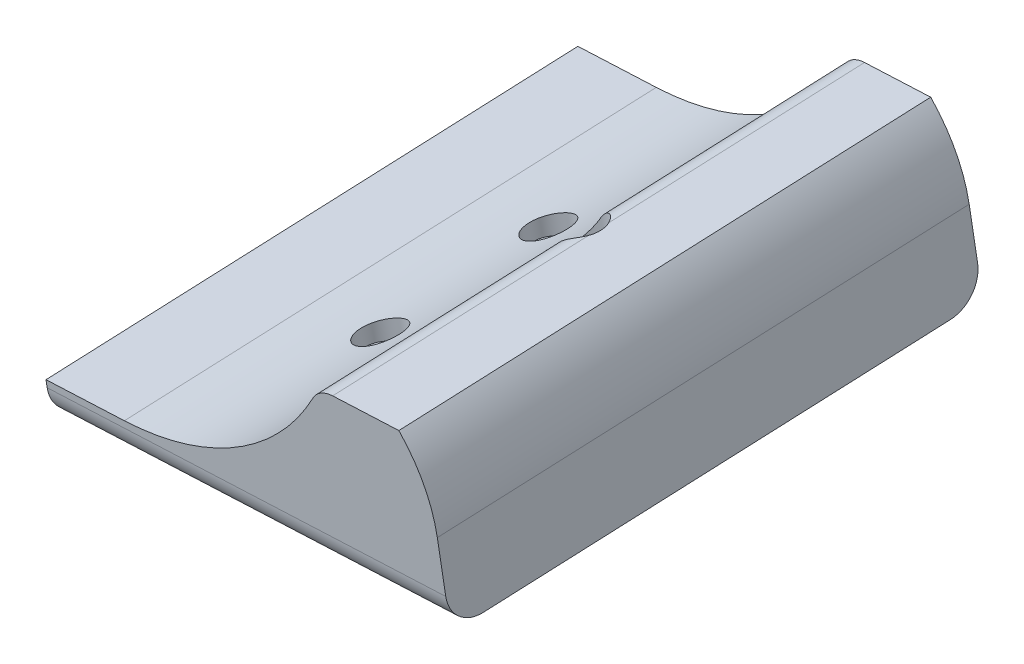
from build123d import *

# Parameters (mm, degrees)
EXTRUDE_1_DEPTH     = 75
CUT_EXTRUDE_2_DEPTH = 89
CUT_EXTRUDE_3_DEPTH = 89
CUT_EXTRUDE_4_DEPTH = 102
FILLET_1_R          = 4
SKETCH_8_R          = 1.7
CUT_EXTRUDE_5_DEPTH = 27
SKETCH_9_R          = 3.1
CUT_EXTRUDE_6_DEPTH = 19.5


with BuildPart() as part:
    # 草图1 → 凸台-拉伸1 (new body)
    with BuildSketch(Plane(origin=(-39.59611161, -89.310119263, 1121.416485544), x_dir=(-0.9993811405079087, 0.0027925735986707154, -0.035064761938558196), z_dir=(0.03517578708588839, 0.07933995566829549, -0.9962267991965691))):
        with BuildLine():
            Line((-262.075571521, 359.155993571), (-261.628696205, 364.135983777))
            Line((-261.628696205, 364.135983777), (-261.435860549, 366.284949367))
            ThreePointArc((-261.435860549, 366.284949367), (-261.109064157, 368.074809297), (-260.463371375, 369.775831132))
            Line((-260.463371375, 369.775831132), (-248.776723549, 393.730780012))
            ThreePointArc((-248.776723549, 393.730780012), (-256.744007891, 423.508755886), (-287.342992795, 419.779467775))
            Line((-287.342992795, 419.779467775), (-315.661768776, 388.401500241))
            ThreePointArc((-315.661768776, 388.401500241), (-319.142063417, 383.007701172), (-320.734355269, 376.78917033))
            Line((-320.734355269, 376.78917033), (-321.388578677, 369.498487569))
            Line((-321.388578677, 369.498487569), (-321.835453993, 364.518497363))
            Line((-321.835453993, 364.518497363), (-262.075571521, 359.155993571))
        make_face()
    extrude(amount=EXTRUDE_1_DEPTH)

    # 草图2 → 切除-拉伸2 (cut)
    with BuildSketch(Plane(origin=(351.495487401, 30.478889762, 14.83831212), x_dir=(0.04186275100976059, 0.0036300044207880334, -0.999116776531052), z_dir=(0.995381658359661, 0.08631157133879107, 0.04201983881692256))):
        with BuildLine():
            Line((-1054.940506582, 279.262299259), (-1060.282877118, 349.349088516))
            Line((-1060.282877118, 349.349088516), (-1174.950235928, 340.60856087))
            Line((-1174.950235928, 340.60856087), (-1169.607865392, 270.521771613))
            Line((-1169.607865392, 270.521771613), (-1168.694349481, 258.537317011))
            Line((-1168.694349481, 258.537317011), (-1168.137997642, 251.238513271))
            ThreePointArc((-1168.137997642, 251.238513271), (-1159.493263254, 234.16850768), (-1141.310196239, 228.210941279))
            Line((-1141.310196239, 228.210941279), (-1076.498210824, 233.151239514))
            ThreePointArc((-1076.498210824, 233.151239514), (-1059.428205233, 241.795973902), (-1053.470638832, 259.979040917))
            Line((-1053.470638832, 259.979040917), (-1054.026990671, 267.277844657))
            Line((-1054.026990671, 267.277844657), (-1054.940506582, 279.262299259))
        make_face()
        with BuildLine():
            Line((-1075.381209674, 277.7042052), (-1079.165486151, 327.350291365))
            Line((-1079.165486151, 327.350291365), (-1152.951438777, 321.725951836))
            Line((-1152.951438777, 321.725951836), (-1149.1671623, 272.079865671))
            Line((-1149.1671623, 272.079865671), (-1148.253646388, 260.095411069))
            Line((-1148.253646388, 260.095411069), (-1147.69729455, 252.79660733))
            ThreePointArc((-1147.69729455, 252.79660733), (-1146.14124236, 249.724006324), (-1142.868290297, 248.651644371))
            Line((-1142.868290297, 248.651644371), (-1078.056304883, 253.591942606))
            ThreePointArc((-1078.056304883, 253.591942606), (-1074.983703877, 255.147994796), (-1073.911341925, 258.420946859))
            Line((-1073.911341925, 258.420946859), (-1074.467693763, 265.719750598))
            Line((-1074.467693763, 265.719750598), (-1075.381209674, 277.7042052))
        make_face(mode=Mode.SUBTRACT)
    extrude(amount=-CUT_EXTRUDE_2_DEPTH, mode=Mode.SUBTRACT)

    # 草图4 → 切除-拉伸3 (cut)
    with BuildSketch(Plane(origin=(-39.578523717, -89.270449285, 1120.918372145), x_dir=(0.9993811405079086, -0.002792573598663483, 0.03506476193856097), z_dir=(-0.03517578708589058, -0.0793399556682715, 0.9962267991965709))):
        with BuildLine():
            Line((273.293580359, 366.186740579), (261.539321142, 365.131981818))
            Line((261.539321142, 365.131981818), (235.445654793, 362.790488178))
            Line((235.445654793, 362.790488178), (232.049402391, 400.638413743))
            ThreePointArc((232.049402391, 400.638413743), (294.258339674, 433.19870407), (273.293580359, 366.186740579))
        make_face()
    extrude(amount=-CUT_EXTRUDE_3_DEPTH, mode=Mode.SUBTRACT)

    # 草图7 → 切除-拉伸4 (cut)
    with BuildSketch(Plane(origin=(-39.578523717, -89.270449285, 1120.918372145), x_dir=(0.9993811405079086, -0.002792573598663483, 0.03506476193856097), z_dir=(-0.03517578708589058, -0.0793399556682715, 0.996226799196571))):
        Polygon((303.866510818, 387.002501991), (315.940576228, 388.085958298), (314.335988901, 405.967521421), (302.261923491, 404.884065114), align=None)
    extrude(amount=-CUT_EXTRUDE_4_DEPTH, mode=Mode.SUBTRACT)

    # 圆角1
    fillet_1_edges = [part.edges().sort_by_distance(p)[0] for p in [
        (265.401440549, 298.597567558, 1125.436762489),
    ]]
    fillet(fillet_1_edges, radius=FILLET_1_R)

    # 草图8 → 切除-拉伸5 (cut)
    with BuildSketch(Plane(origin=(-29.90386421, 332.486882621, 25.423530653), x_dir=(0.9960030029050818, 0.0890597720529966, 0.0068099343556353885), z_dir=(0.08931975259739458, -0.9931039643902253, -0.07593745919082608))):
        with Locations(Location((277.335448654, 1110.342499925, 0), (0, 0, 359.608686584))):
            Circle(SKETCH_8_R)
        with Locations(Location((297.985718495, 1099.373618692, 0), (0, 0, 359.608686584))):
            Circle(SKETCH_8_R)
        with Locations(Location((278.161253776, 1086.974401032, 0), (0, 0, 359.608686584))):
            Circle(SKETCH_8_R)
    extrude(amount=-CUT_EXTRUDE_5_DEPTH, mode=Mode.SUBTRACT)

    # 草图9 → 切除-拉伸6 (cut)
    with BuildSketch(Plane(origin=(-32.002878396, 355.824825784, 27.208060944), x_dir=(0.9960030029050824, 0.08905977205298932, 0.006809934355638229), z_dir=(-0.08931975259738754, 0.9931039643902232, 0.07593745919086373))):
        with Locations(Location((278.161253776, -1086.974401032, 0), (0, 0, 180.391313416))):
            Circle(SKETCH_9_R)
        with Locations(Location((297.985718495, -1099.373618692, 0), (0, 0, 258.436796429))):
            Circle(SKETCH_9_R)
        with Locations(Location((277.335448654, -1110.342499925, 0), (0, 0, 180.391313416))):
            Circle(SKETCH_9_R)
    extrude(amount=-CUT_EXTRUDE_6_DEPTH, mode=Mode.SUBTRACT)


solid = part.part
